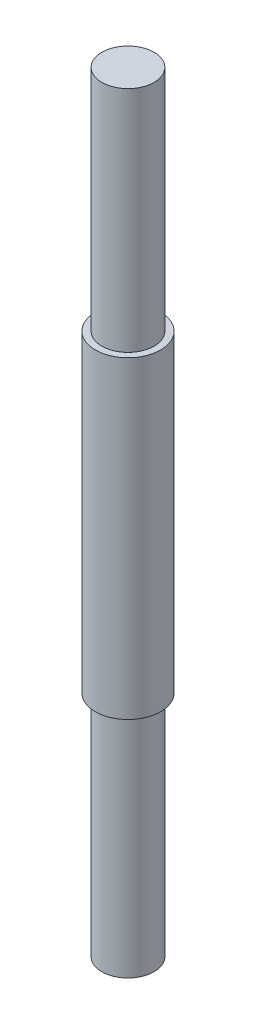
from build123d import *

# Parameters (mm, degrees)
SKETCH_1_R      = 5
EXTRUDE_1_DEPTH = 48
SKETCH_3_R      = 4
EXTRUDE_2_DEPTH = 35
EXTRUDE_START   = 35
SKETCH_4_R      = 4
EXTRUDE_3_DEPTH = 35


with BuildPart() as part:
    # 草图1 → 凸台-拉伸1 (new body)
    with BuildSketch(Plane(origin=(0, 0, 0), x_dir=(1, 0, 0), z_dir=(0, 1, 0))):
        with Locations(Location((0, 0, 0), (0, 0, 270))):
            Circle(SKETCH_1_R)
    extrude(amount=EXTRUDE_1_DEPTH)

    # 草图3 → 凸台-拉伸2 (add)
    with BuildSketch(Plane.XZ):
        with Locations(Location((0, 0, 0), (0, 0, 90))):
            Circle(SKETCH_3_R)
    extrude(amount=EXTRUDE_2_DEPTH)

    # 草图4 → 凸台-拉伸3 (add)
    with BuildSketch(Plane(origin=(0, 48, 0), x_dir=(1, 0, 0), z_dir=(0, 1, 0)).offset(EXTRUDE_START)):
        with Locations(Location((0, 0, 0), (0, 0, 270))):
            Circle(SKETCH_4_R)
    extrude(amount=-EXTRUDE_3_DEPTH)


solid = part.part
